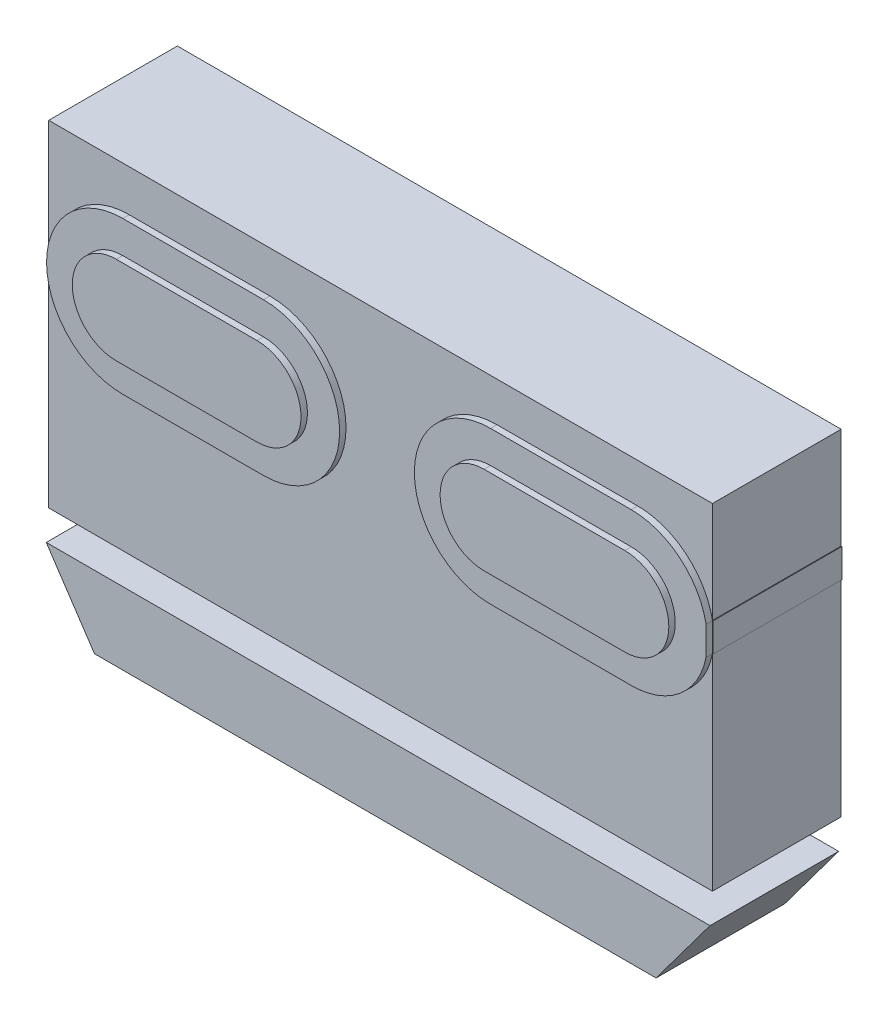
from build123d import *

# Parameters (mm, degrees)
BOSS_EXTRUDE2_DEPTH = 20
BOSS_EXTRUDE3_DEPTH = 20
SKETCH2_W           = 20
SKETCH2_H           = 4.478337627
BOSS_EXTRUDE4_DEPTH = 0.1
BOSS_EXTRUDE6_DEPTH = 21
BOSS_EXTRUDE7_DEPTH = 22


with BuildPart() as part:
    # Sketch1 → Boss-Extrude2 (new body)
    with BuildSketch(Plane.XY):
        with BuildLine():
            Line((26.430090028, 27.574352135), (-76.761417751, 27.574352135))
            Line((-76.761417751, 27.574352135), (-76.761417751, -24.620243368))
            Line((-76.761417751, -24.620243368), (26.430090028, -24.620243368))
            Line((26.430090028, -24.620243368), (26.430090028, 7.355287067))
            ThreePointArc((26.430090028, 7.355287067), (22.343684755, 0.466997357), (14.806753156, -2.242597682))
            Line((14.806753156, -2.242597682), (-7.076489516, -2.242597682))
            ThreePointArc((-7.076489516, -2.242597682), (-18.913543078, 9.594455881), (-7.076489516, 21.431509443))
            Line((-7.076489516, 21.431509443), (14.806753156, 21.431509443))
            ThreePointArc((14.806753156, 21.431509443), (22.343684755, 18.721914404), (26.430090028, 11.833624694))
            Line((26.430090028, 11.833624694), (26.430090028, 27.574352135))
        make_face()
        with BuildLine():
            ThreePointArc((-64.258353778, -2.561422734), (-76.095407341, 9.275630828), (-64.258353778, 21.11268439))
            Line((-64.258353778, 21.11268439), (-42.375111107, 21.11268439))
            ThreePointArc((-42.375111107, 21.11268439), (-30.538057545, 9.275630828), (-42.375111107, -2.561422734))
            Line((-42.375111107, -2.561422734), (-64.258353778, -2.561422734))
        make_face(mode=Mode.SUBTRACT)
    extrude(amount=BOSS_EXTRUDE2_DEPTH)



with BuildPart() as body_2:
    # Sketch1<6> → Boss-Extrude3 (new body)
    with BuildSketch(Plane.XY):
        Polygon((26.046102884, -29.45332066), (-77.145404895, -29.45332066), (-69.645687176, -40.69387077), (17.664278645, -40.69387077), align=None)
    extrude(amount=BOSS_EXTRUDE3_DEPTH)


with BuildPart() as body_3:
    # Sketch2 → Boss-Extrude4 (new body)
    with BuildSketch(Plane(origin=(26.430090028, 0, 0), x_dir=(0, 0, -1), z_dir=(1, 0, 0))):
        with Locations((-10, 9.59445588)):
            Rectangle(SKETCH2_W, SKETCH2_H)
    extrude(amount=BOSS_EXTRUDE4_DEPTH)


with BuildPart() as part_1:
    add(part.part)

    add(body_3.part)  # Boss-Extrude6 merges body 3
    # Sketch1<8> → Boss-Extrude6 (add)
    with BuildSketch(Plane.XY):
        with BuildLine():
            Line((26.430090028, 7.355287067), (26.430090028, 11.833624694))
            ThreePointArc((26.430090028, 11.833624694), (22.343684755, 18.721914404), (14.806753156, 21.431509443))
            Line((14.806753156, 21.431509443), (-7.076489516, 21.431509443))
            ThreePointArc((-7.076489516, 21.431509443), (-18.913543078, 9.594455881), (-7.076489516, -2.242597682))
            Line((-7.076489516, -2.242597682), (14.806753156, -2.242597682))
            ThreePointArc((14.806753156, -2.242597682), (22.343684755, 0.466997357), (26.430090028, 7.355287067))
        make_face()
        with BuildLine():
            Line((-42.375111107, 21.11268439), (-64.258353778, 21.11268439))
            ThreePointArc((-64.258353778, 21.11268439), (-76.095407341, 9.275630828), (-64.258353778, -2.561422734))
            Line((-64.258353778, -2.561422734), (-42.375111107, -2.561422734))
            ThreePointArc((-42.375111107, -2.561422734), (-30.538057545, 9.275630828), (-42.375111107, 21.11268439))
        make_face()
    extrude(amount=BOSS_EXTRUDE6_DEPTH)

    # Sketch1<9> → Boss-Extrude7 (add)
    with BuildSketch(Plane.XY):
        with BuildLine():
            Line((-64.258353778, 16.11268439), (-42.375111107, 16.11268439))
            ThreePointArc((-42.375111107, 16.11268439), (-35.538057545, 9.275630828), (-42.375111107, 2.438577266))
            Line((-42.375111107, 2.438577266), (-64.258353778, 2.438577266))
            ThreePointArc((-64.258353778, 2.438577266), (-71.095407341, 9.275630828), (-64.258353778, 16.11268439))
        make_face()
        with BuildLine():
            Line((-7.076489516, 16.431509443), (14.806753156, 16.431509443))
            ThreePointArc((14.806753156, 16.431509443), (21.643806718, 9.594455881), (14.806753156, 2.757402318))
            Line((14.806753156, 2.757402318), (-7.076489516, 2.757402318))
            ThreePointArc((-7.076489516, 2.757402318), (-13.913543078, 9.594455881), (-7.076489516, 16.431509443))
        make_face()
    extrude(amount=BOSS_EXTRUDE7_DEPTH)


solid = Compound([body_2.part, part_1.part])
